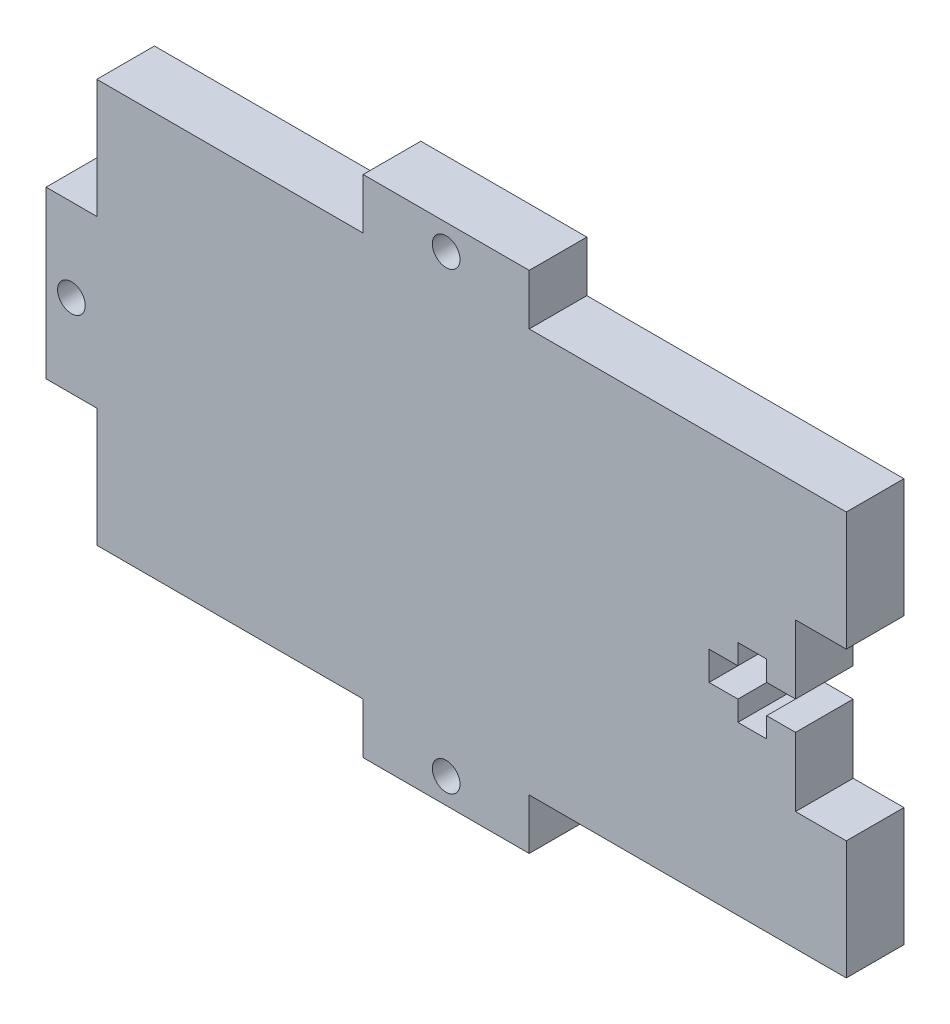
from build123d import *

# Parameters (mm, degrees)
SKETCH1_W           = 82.55
SKETCH1_H           = 44.45
BOSS_EXTRUDE1_DEPTH = 6.35
SKETCH2_W           = 5.588
SKETCH2_H           = 18.288
BOSS_EXTRUDE2_DEPTH = 6.35
SKETCH5_W           = 18.288
SKETCH5_H           = 5.588
BOSS_EXTRUDE3_DEPTH = 6.35
SKETCH3_W           = 5.588
SKETCH3_H           = 18.288
CUT_EXTRUDE1_DEPTH  = 97.739994025
SKETCH6_R           = 1.524
CUT_EXTRUDE2_DEPTH  = 97.739994025


with BuildPart() as part:
    # Sketch1 → Boss-Extrude1 (new body)
    with BuildSketch(Plane.XY):
        with Locations((41.275, 22.225)):
            Rectangle(SKETCH1_W, SKETCH1_H)
    extrude(amount=BOSS_EXTRUDE1_DEPTH)

    # Sketch2 → Boss-Extrude2 (add)
    with BuildSketch(Plane.XY.offset(6.35)):
        with Locations((-2.794, 22.225)):
            Rectangle(SKETCH2_W, SKETCH2_H)
    extrude(amount=-BOSS_EXTRUDE2_DEPTH)

    # Sketch5 → Boss-Extrude3 (add)
    with BuildSketch(Plane.XY.offset(6.35)):
        with Locations((38.481, 47.244)):
            Rectangle(SKETCH5_W, SKETCH5_H)
        with Locations((38.481, -2.794)):
            Rectangle(SKETCH5_W, SKETCH5_H)
    extrude(amount=-BOSS_EXTRUDE3_DEPTH)

    # Sketch3 → Cut-Extrude1 (cut, through all)
    with BuildSketch(Plane.XY.offset(6.35)):
        with Locations((79.756, 22.225)):
            Rectangle(SKETCH3_W, SKETCH3_H)
    extrude(amount=-CUT_EXTRUDE1_DEPTH, mode=Mode.SUBTRACT)

    # Sketch6 → Cut-Extrude2 (cut, through all)
    with BuildSketch(Plane.XY.offset(6.35)):
        with Locations((-2.794, 22.225)):
            Circle(SKETCH6_R)
        with Locations((38.481, -2.794)):
            Circle(SKETCH6_R)
        with Locations((38.481, 47.244)):
            Circle(SKETCH6_R)
        Polygon((67.437, 23.8125), (70.612, 23.8125), (70.612, 26.035), (73.787, 26.035), (73.787, 23.8125), (76.962, 23.8125), (76.962, 20.6375), (73.787, 20.6375), (73.787, 18.415), (70.612, 18.415), (70.612, 20.6375), (67.437, 20.6375), align=None)
    extrude(amount=-CUT_EXTRUDE2_DEPTH, mode=Mode.SUBTRACT)


solid = part.part
